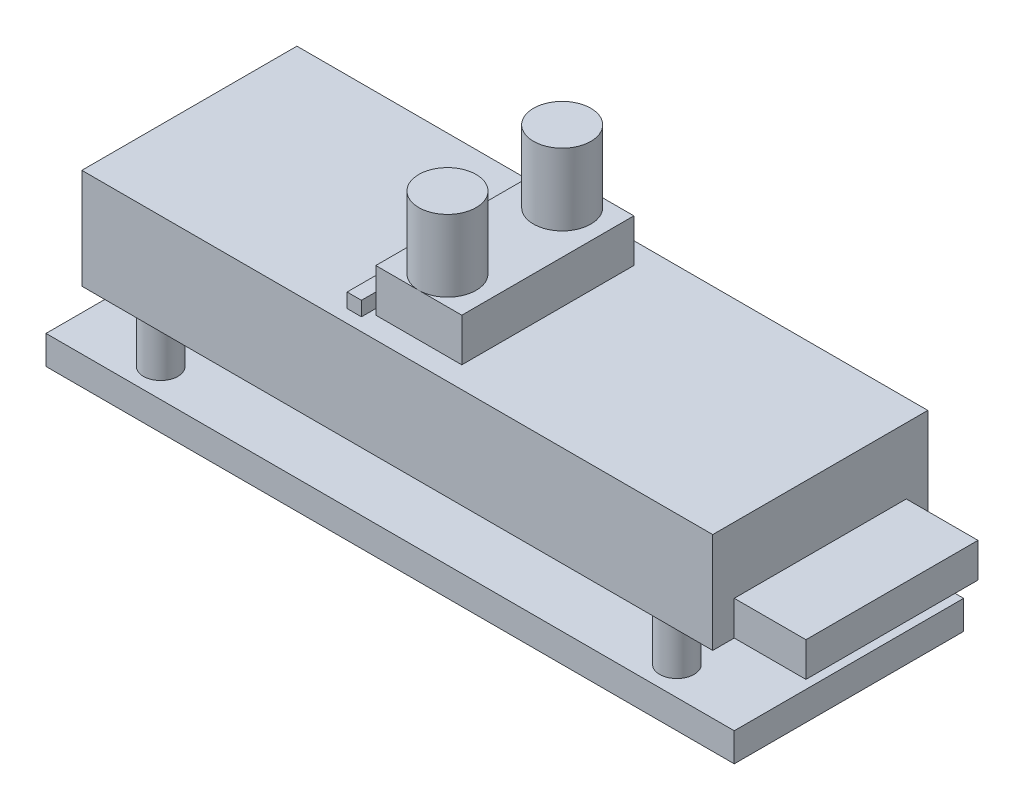
from build123d import *

# Parameters (mm, degrees)
SKETCH1_W            = 2400
SKETCH1_H            = 800
BOSS_EXTRUDE1_DEPTH  = 100
BOSS_EXTRUDE2_START  = 100
SKETCH2_R            = 60
BOSS_EXTRUDE2_DEPTH  = 180
BOSS_EXTRUDE3_START  = 100
SKETCH3_R            = 60
BOSS_EXTRUDE3_DEPTH  = 180
BOSS_EXTRUDE4_START  = 100
SKETCH4_R            = 60
BOSS_EXTRUDE4_DEPTH  = 180
BOSS_EXTRUDE5_START  = 100
SKETCH5_R            = 60
BOSS_EXTRUDE5_DEPTH  = 180
BOSS_EXTRUDE6_START  = 280
SKETCH6_W            = 2200
SKETCH6_H            = 750
BOSS_EXTRUDE6_DEPTH  = 350
BOSS_EXTRUDE7_START  = 280
SKETCH7_W            = 250
SKETCH7_H            = 600
BOSS_EXTRUDE7_DEPTH  = 120
BOSS_EXTRUDE8_START  = 650
SKETCH8_W            = 50
SKETCH8_H            = 700
BOSS_EXTRUDE8_DEPTH  = 50
BOSS_EXTRUDE9_START  = 630
SKETCH9_W            = 300
SKETCH9_H            = 600
BOSS_EXTRUDE9_DEPTH  = 150
BOSS_EXTRUDE10_START = 780
SKETCH10_R           = 100
BOSS_EXTRUDE10_DEPTH = 250
BOSS_EXTRUDE11_START = 780
SKETCH11_R           = 100
BOSS_EXTRUDE11_DEPTH = 250
BOSS_EXTRUDE12_START = -280
SKETCH12_R           = 55
BOSS_EXTRUDE12_DEPTH = 180


with BuildPart() as part:
    # Sketch1 → Boss-Extrude1 (new body)
    with BuildSketch(Plane(origin=(0, 0, 0), x_dir=(1, 0, 0), z_dir=(0, 1, 0))):
        Rectangle(SKETCH1_W, SKETCH1_H)
    extrude(amount=BOSS_EXTRUDE1_DEPTH)

    # Sketch2 → Boss-Extrude2 (add)
    with BuildSketch(Plane(origin=(0, 0, 0), x_dir=(1, 0, 0), z_dir=(0, 1, 0)).offset(BOSS_EXTRUDE2_START)):
        with Locations(Location((-900, -300, 0), (0, 0, 90))):
            Circle(SKETCH2_R)
    extrude(amount=BOSS_EXTRUDE2_DEPTH)

    # Sketch3 → Boss-Extrude3 (add)
    with BuildSketch(Plane(origin=(0, 0, 0), x_dir=(1, 0, 0), z_dir=(0, 1, 0)).offset(BOSS_EXTRUDE3_START)):
        with Locations(Location((-900, 300, 0), (0, 0, 90))):
            Circle(SKETCH3_R)
    extrude(amount=BOSS_EXTRUDE3_DEPTH)

    # Sketch4 → Boss-Extrude4 (add)
    with BuildSketch(Plane(origin=(0, 0, 0), x_dir=(1, 0, 0), z_dir=(0, 1, 0)).offset(BOSS_EXTRUDE4_START)):
        with Locations(Location((900, -300, 0), (0, 0, 90))):
            Circle(SKETCH4_R)
    extrude(amount=BOSS_EXTRUDE4_DEPTH)

    # Sketch5 → Boss-Extrude5 (add)
    with BuildSketch(Plane(origin=(0, 0, 0), x_dir=(1, 0, 0), z_dir=(0, 1, 0)).offset(BOSS_EXTRUDE5_START)):
        with Locations(Location((900, 300, 0), (0, 0, 90))):
            Circle(SKETCH5_R)
    extrude(amount=BOSS_EXTRUDE5_DEPTH)

    # Sketch6 → Boss-Extrude6 (add)
    with BuildSketch(Plane(origin=(0, 0, 0), x_dir=(1, 0, 0), z_dir=(0, 1, 0)).offset(BOSS_EXTRUDE6_START)):
        Rectangle(SKETCH6_W, SKETCH6_H)
    extrude(amount=BOSS_EXTRUDE6_DEPTH)

    # Sketch7 → Boss-Extrude7 (add)
    with BuildSketch(Plane(origin=(0, 0, 0), x_dir=(1, 0, 0), z_dir=(0, 1, 0)).offset(BOSS_EXTRUDE7_START)):
        with Locations((1225, 0)):
            Rectangle(SKETCH7_W, SKETCH7_H)
    extrude(amount=BOSS_EXTRUDE7_DEPTH)



with BuildPart() as body_2:
    # Sketch8 → Boss-Extrude8 (new body)
    with BuildSketch(Plane(origin=(0, 0, 0), x_dir=(1, 0, 0), z_dir=(0, 1, 0)).offset(BOSS_EXTRUDE8_START)):
        with Locations((-175, 0)):
            Rectangle(SKETCH8_W, SKETCH8_H)
    extrude(amount=BOSS_EXTRUDE8_DEPTH)


with BuildPart() as part_1:
    add(part.part)

    add(body_2.part)  # Boss-Extrude9 merges body 2
    # Sketch9 → Boss-Extrude9 (add)
    with BuildSketch(Plane(origin=(0, 0, 0), x_dir=(1, 0, 0), z_dir=(0, 1, 0)).offset(BOSS_EXTRUDE9_START)):
        Rectangle(SKETCH9_W, SKETCH9_H)
    extrude(amount=BOSS_EXTRUDE9_DEPTH)

    # Sketch10 → Boss-Extrude10 (add)
    with BuildSketch(Plane(origin=(0, 0, 0), x_dir=(1, 0, 0), z_dir=(0, 1, 0)).offset(BOSS_EXTRUDE10_START)):
        with Locations(Location((0, -200, 0), (0, 0, 270))):
            Circle(SKETCH10_R)
    extrude(amount=BOSS_EXTRUDE10_DEPTH)

    # Sketch11 → Boss-Extrude11 (add)
    with BuildSketch(Plane(origin=(0, 0, 0), x_dir=(1, 0, 0), z_dir=(0, 1, 0)).offset(BOSS_EXTRUDE11_START)):
        with Locations(Location((0, 200, 0), (0, 0, 90))):
            Circle(SKETCH11_R)
    extrude(amount=BOSS_EXTRUDE11_DEPTH)


with BuildPart() as body_2_2:
    # Sketch12 → Boss-Extrude12 (new body)
    with BuildSketch(Plane(origin=(0, 0, 0), x_dir=(1, 0, 0), z_dir=(0, 1, 0)).offset(BOSS_EXTRUDE12_START)):
        with Locations(Location((0, 0, 0), (0, 0, 90))):
            Circle(SKETCH12_R)
    extrude(amount=BOSS_EXTRUDE12_DEPTH)


solid = Compound([part_1.part, body_2_2.part])
